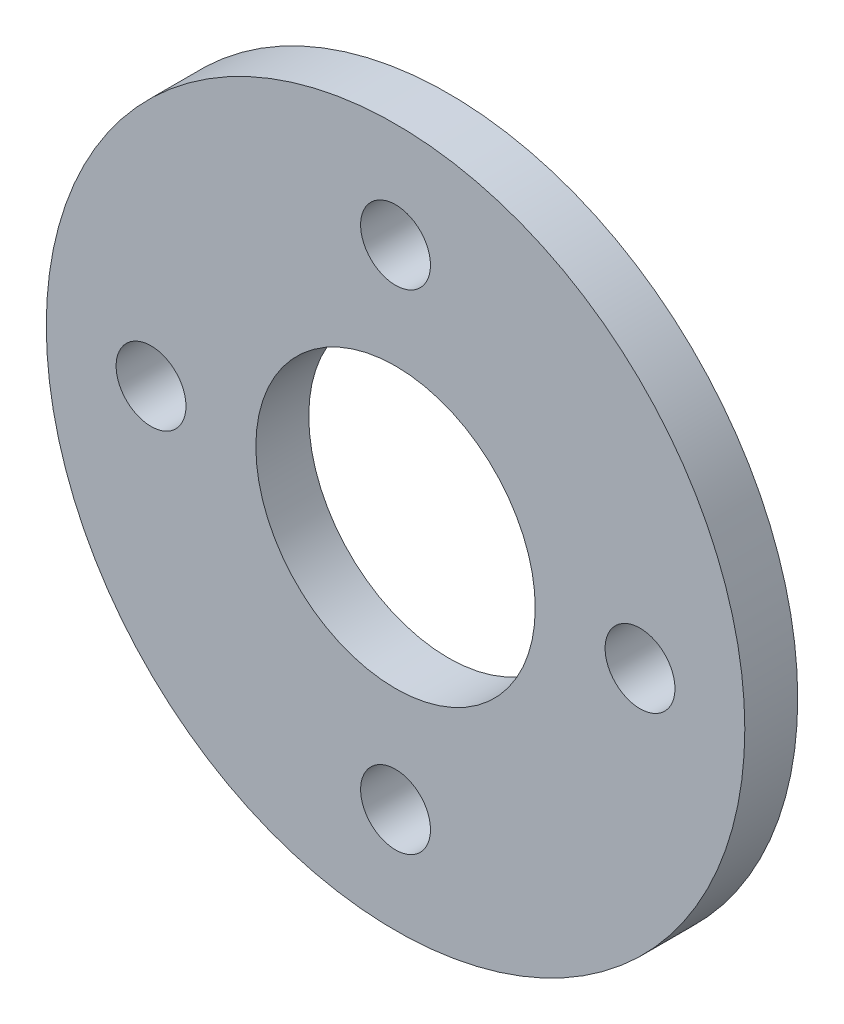
from build123d import *

# Parameters (mm, degrees)
IZIM1_R                     = 10
IZIM1_R_2                   = 4
IZIM1_R_3                   = 1
Y_KSEKLIK_EKSTR_ZYON1_DEPTH = 1.515


with BuildPart() as part:
    # Çizim1 → Yükseklik-Ekstrüzyon1 (new body)
    with BuildSketch(Plane.XY):
        Circle(IZIM1_R)
        Circle(IZIM1_R_2, mode=Mode.SUBTRACT)
        with Locations((-7, 0)):
            Circle(IZIM1_R_3, mode=Mode.SUBTRACT)
        with Locations((0, 7)):
            Circle(IZIM1_R_3, mode=Mode.SUBTRACT)
        with Locations((7, 0)):
            Circle(IZIM1_R_3, mode=Mode.SUBTRACT)
        with Locations((0, -7)):
            Circle(IZIM1_R_3, mode=Mode.SUBTRACT)
    extrude(amount=Y_KSEKLIK_EKSTR_ZYON1_DEPTH)


solid = part.part
